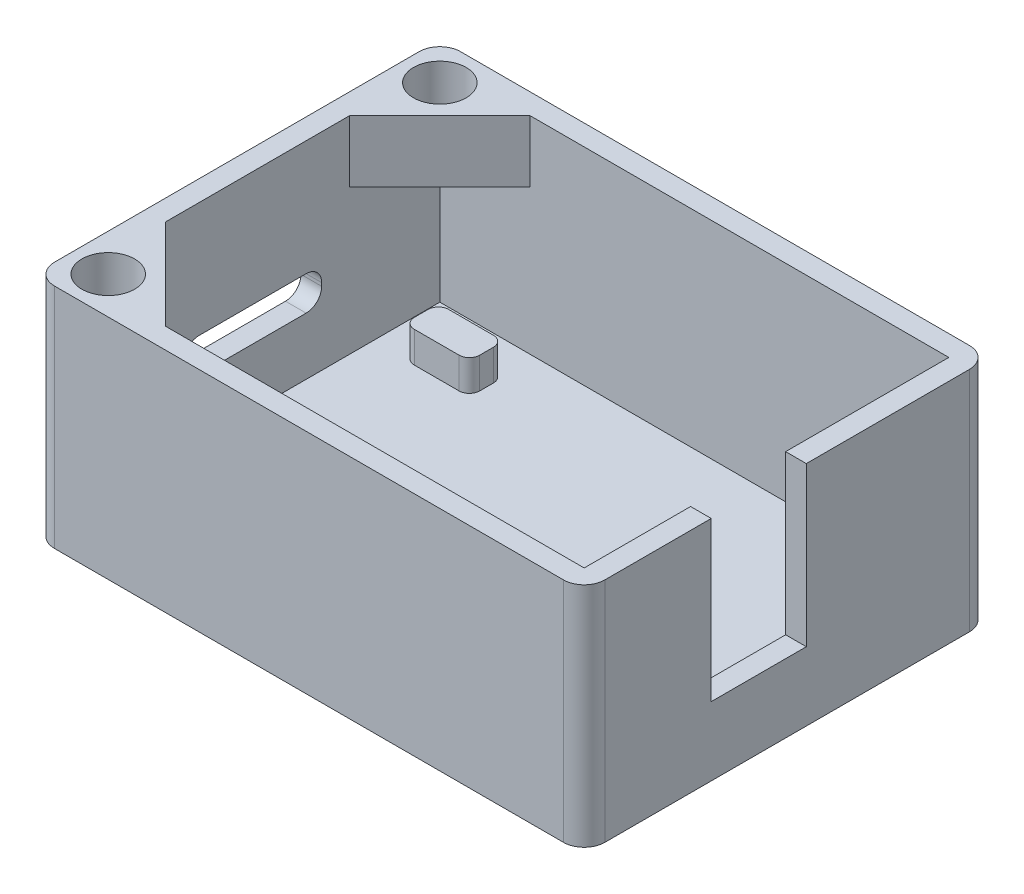
from build123d import *

# Parameters (mm, degrees)
SKETCH1_W           = 53.26
SKETCH1_H           = 39.29
BOSS_EXTRUDE1_DEPTH = 2
SKETCH2_W           = 53.26
SKETCH2_H           = 39.29
SKETCH2_W_2         = 49.26
SKETCH2_H_2         = 35.29
BOSS_EXTRUDE2_DEPTH = 20
SKETCH3_R           = 2
BOSS_EXTRUDE3_DEPTH = 3
SKETCH5_R           = 1.45
BOSS_EXTRUDE4_DEPTH = 1.6
CUT_EXTRUDE1_REACH  = 62.881
SKETCH6_W           = 9.2
SKETCH6_H           = 15.35
BOSS_EXTRUDE5_DEPTH = 6
SKETCH8_R           = 2.55
CUT_EXTRUDE2_DEPTH  = 4.2
CUT_EXTRUDE3_REACH  = 62.881
SKETCH9_W           = 13.35
SKETCH9_H           = 3.308526937
FILLET2_R           = 2
FILLET3_R           = 1.5
SKETCH10_W          = 1.076923076
SKETCH10_H          = 6.153846154
SKETCH10_W_2        = 1.076923077
SKETCH10_H_2        = 4.384615385
SKETCH10_W_3        = 2.076923077
SKETCH10_H_3        = 1
SKETCH10_H_4        = 4.384615384
CUT_EXTRUDE4_DEPTH  = 1


with BuildPart() as part:
    # Sketch1 → Boss-Extrude1 (new body)
    with BuildSketch(Plane(origin=(0, 0, 0), x_dir=(1, 0, 0), z_dir=(0, 1, 0))):
        Rectangle(SKETCH1_W, SKETCH1_H)
    extrude(amount=BOSS_EXTRUDE1_DEPTH)

    # Sketch2 → Boss-Extrude2 (add)
    with BuildSketch(Plane(origin=(0, 2, 0), x_dir=(1, 0, 0), z_dir=(0, 1, 0))):
        Rectangle(SKETCH2_W, SKETCH2_H)
        Rectangle(SKETCH2_W_2, SKETCH2_H_2, mode=Mode.SUBTRACT)
    extrude(amount=BOSS_EXTRUDE2_DEPTH)

    # Sketch3 → Boss-Extrude3 (add)
    with BuildSketch(Plane(origin=(0, 2, 0), x_dir=(1, 0, 0), z_dir=(0, 1, 0))):
        with Locations(Location((21.844, -14.732, 0), (0, 0, 270))):
            Circle(SKETCH3_R)
        with Locations(Location((-21.59, -14.732, 0), (0, 0, 270))):
            Circle(SKETCH3_R)
        with BuildLine():
            Line((-20.59, 14.465843174), (-16.261037059, 14.465843174))
            ThreePointArc((-16.261037059, 14.465843174), (-15.553930278, 14.172949955), (-15.261037059, 13.465843174))
            Line((-15.261037059, 13.465843174), (-15.261037059, 12.137442323))
            ThreePointArc((-15.261037059, 12.137442323), (-15.553930278, 11.430335542), (-16.261037059, 11.137442323))
            Line((-16.261037059, 11.137442323), (-20.59, 11.137442323))
            ThreePointArc((-20.59, 11.137442323), (-21.297106781, 11.430335542), (-21.59, 12.137442323))
            Line((-21.59, 12.137442323), (-21.59, 13.465843174))
            ThreePointArc((-21.59, 13.465843174), (-21.297106781, 14.172949955), (-20.59, 14.465843174))
        make_face()
        with BuildLine():
            Line((15.261037059, 13.465843174), (15.261037059, 12.137442323))
            ThreePointArc((15.261037059, 12.137442323), (15.553930278, 11.430335542), (16.261037059, 11.137442323))
            Line((16.261037059, 11.137442323), (20.59, 11.137442323))
            ThreePointArc((20.59, 11.137442323), (21.297106781, 11.430335542), (21.59, 12.137442323))
            Line((21.59, 12.137442323), (21.59, 13.465843174))
            ThreePointArc((21.59, 13.465843174), (21.297106781, 14.172949955), (20.59, 14.465843174))
            Line((20.59, 14.465843174), (16.261037059, 14.465843174))
            ThreePointArc((16.261037059, 14.465843174), (15.553930278, 14.172949955), (15.261037059, 13.465843174))
        make_face()
    extrude(amount=BOSS_EXTRUDE3_DEPTH)

    # Sketch5 → Boss-Extrude4 (add)
    with BuildSketch(Plane(origin=(0, 5, 0), x_dir=(1, 0, 0), z_dir=(0, 1, 0))):
        with Locations(Location((-21.59, -14.732, 0), (0, 0, 270))):
            Circle(SKETCH5_R)
        with Locations(Location((21.844, -14.732, 0), (0, 0, 270))):
            Circle(SKETCH5_R)
    extrude(amount=BOSS_EXTRUDE4_DEPTH)

    # Sketch6 → Cut-Extrude1 (cut, up to next)
    with BuildSketch(Plane(origin=(26.63, 0, 0), x_dir=(0, 0, -1), z_dir=(1, 0, 0)), mode=Mode.PRIVATE) as cut_extrude1_sk1:
        with Locations((-2.748, 14.325)):
            Rectangle(SKETCH6_W, SKETCH6_H)
    cut_extrude1_tool1 = extrude(cut_extrude1_sk1.sketch, amount=-CUT_EXTRUDE1_REACH, mode=Mode.PRIVATE) & part.part
    add(cut_extrude1_tool1.solids().sort_by_distance((26.63, 14.325, 2.748))[0], mode=Mode.SUBTRACT)

    # Sketch7 → Boss-Extrude5 (add)
    with BuildSketch(Plane(origin=(0, 22, 0), x_dir=(1, 0, 0), z_dir=(0, 1, 0))):
        Polygon((-26.63, 19.645), (-13.902077939, 19.645), (-26.63, 6.917077939), align=None)
        Polygon((-26.63, -19.645), (-13.902077939, -19.645), (-26.63, -6.917077939), align=None)
    extrude(amount=-BOSS_EXTRUDE5_DEPTH)

    # Sketch8 → Cut-Extrude2 (cut)
    with BuildSketch(Plane(origin=(0, 22, 0), x_dir=(1, 0, 0), z_dir=(0, 1, 0))):
        with Locations(Location((-23.03, 16.045, 0), (0, 0, 270))):
            Circle(SKETCH8_R)
        with Locations(Location((-23.03, -16.045, 0), (0, 0, 90))):
            Circle(SKETCH8_R)
    extrude(amount=-CUT_EXTRUDE2_DEPTH, mode=Mode.SUBTRACT)

    # Sketch9 → Cut-Extrude3 (cut, up to next)
    with BuildSketch(Plane.ZY.offset(26.63), mode=Mode.PRIVATE) as cut_extrude3_sk1:
        with Locations((0.468, 9.204263469)):
            Rectangle(SKETCH9_W, SKETCH9_H)
    cut_extrude3_tool1 = extrude(cut_extrude3_sk1.sketch, amount=-CUT_EXTRUDE3_REACH, mode=Mode.PRIVATE) & part.part
    add(cut_extrude3_tool1.solids().sort_by_distance((-26.63, 9.204263, 0.468))[0], mode=Mode.SUBTRACT)

    # Fillet2
    fillet2_edges = [part.edges().sort_by_distance(p)[0] for p in [
        (-26.63, 11, -19.645),
        (26.63, 11, -19.645),
        (26.63, 11, 19.645),
        (-26.63, 11, 19.645),
    ]]
    fillet(fillet2_edges, radius=FILLET2_R)

    # Fillet3
    fillet3_edges = [part.edges().sort_by_distance(p)[0] for p in [
        (-25.63, 7.55, -6.207),
        (-25.63, 10.858526937, 7.143),
        (-25.63, 7.55, 7.143),
        (-25.63, 10.858526937, -6.207),
    ]]
    fillet(fillet3_edges, radius=FILLET3_R)

    # Sketch10 → Cut-Extrude4 (cut)
    # profile 1 of 21: a face of its own
    with BuildSketch(Plane(origin=(0, 0, 0), x_dir=(-1, 0, 0), z_dir=(0, -1, 0))):
        with BuildLine():
            Line((-14.805590013, 7.334367776), (-15.595253474, 6.579560084))
            add(Edge.make_bspline(
                [(-15.595253474, 6.579560084), (-15.662239162, 6.648823398), (-15.793083197, 6.784116349), (-16.003922177, 6.963232293), (-16.223187039, 7.112501198), (-16.446612424, 7.238214519), (-16.678217106, 7.333325605), (-16.915323104, 7.402634656), (-17.15944441, 7.444889765), (-17.32465632, 7.449724497), (-17.407753474, 7.452156238)],
                knots=[0, 0, 0, 0, 1.115251505, 2.178435587, 3.19620269, 4.182487026, 5.141301733, 6.088180966, 7.038406374, 8, 8, 8, 8], degree=3))
            add(Edge.make_bspline(
                [(-17.407753474, 7.452156238), (-17.477149696, 7.450235078), (-17.614095493, 7.44644388), (-17.81516781, 7.418650663), (-18.007503873, 7.371387087), (-18.191762078, 7.306249125), (-18.367400239, 7.221964059), (-18.534786602, 7.118597123), (-18.693508483, 6.997081869), (-18.841469257, 6.858047021), (-18.976818574, 6.706141002), (-19.096408314, 6.544057642), (-19.196583904, 6.372168266), (-19.278796382, 6.192213641), (-19.342836723, 6.003360849), (-19.388569573, 5.805737034), (-19.415020232, 5.599106841), (-19.41896817, 5.458641175), (-19.420974628, 5.387252392)],
                knots=[0, 0, 0, 0, 1.035432265, 2.043311493, 3.022114605, 3.98653278, 4.95457646, 5.923598177, 6.917315552, 7.932509744, 8.948865224, 9.949768934, 10.933144597, 11.912367597, 12.897413939, 13.903909035, 14.934704909, 16, 16, 16, 16], degree=3))
            add(Edge.make_bspline(
                [(-19.420974628, 5.387252392), (-19.42039639, 5.337146749), (-19.41925667, 5.238387496), (-19.406780422, 5.092295153), (-19.386690721, 4.950551041), (-19.357615946, 4.813369867), (-19.321257654, 4.680632748), (-19.278601099, 4.551194566), (-19.225089078, 4.426843867), (-19.165689928, 4.306136398), (-19.0966094, 4.192365813), (-19.022127848, 4.083876118), (-18.941364765, 3.981199118), (-18.853797044, 3.884754562), (-18.758192278, 3.79604966), (-18.657021496, 3.712416951), (-18.548578089, 3.635950045), (-18.435114699, 3.56472992), (-18.315651147, 3.502860392), (-18.193428756, 3.446818553), (-18.066594388, 3.401304247), (-17.936692328, 3.364615564), (-17.804186799, 3.333417319), (-17.667781775, 3.314207601), (-17.528659717, 3.299660306), (-17.434636557, 3.298762095), (-17.387320782, 3.298310084)],
                knots=[0, 0, 0, 0, 1.103660481, 2.175337485, 3.227646561, 4.255952547, 5.262355991, 6.258840057, 7.255597736, 8.242457506, 9.22035537, 10.185017736, 11.140346927, 12.096287581, 13.051739095, 14.01125915, 14.986044842, 15.97314143, 16.960198552, 17.947847494, 18.933482797, 19.925264591, 20.920966487, 21.929612487, 22.958107872, 24, 24, 24, 24], degree=3))
            add(Edge.make_bspline(
                [(-17.387320782, 3.298310084), (-17.307065096, 3.300631504), (-17.149383542, 3.305192492), (-16.917963189, 3.340858767), (-16.697442648, 3.39952777), (-16.521247791, 3.468812455), (-16.383203775, 3.53723198), (-16.278112906, 3.600516672), (-16.169440757, 3.671307548), (-16.058992278, 3.752276333), (-15.945525145, 3.842451368), (-15.831042313, 3.943807655), (-15.712613002, 4.053007678), (-15.635031134, 4.130945879), (-15.595253474, 4.170906238)],
                knots=[0, 0, 0, 0, 1.404581149, 2.759636711, 4.088442092, 5.392261763, 6.066678138, 6.783632037, 7.538459478, 8.336747902, 9.180226004, 10.074962426, 11.012997595, 12, 12, 12, 12], degree=3))
            Line((-15.595253474, 4.170906238), (-14.829628474, 3.366819699))
            add(Edge.make_bspline(
                [(-14.829628474, 3.366819699), (-14.883447791, 3.314858839), (-14.988491587, 3.213442352), (-15.146947237, 3.069440403), (-15.305203465, 2.940038645), (-15.459437129, 2.820540359), (-15.612174738, 2.714426821), (-15.763400094, 2.621592055), (-15.91140126, 2.539688135), (-16.059251528, 2.47009633), (-16.207870899, 2.41100566), (-16.360782765, 2.360132472), (-16.518454595, 2.317095585), (-16.681849375, 2.282370469), (-16.849443058, 2.254525614), (-17.022804098, 2.235730498), (-17.200833301, 2.223095167), (-17.321593268, 2.221959777), (-17.38251309, 2.221387007)],
                knots=[0, 0, 0, 0, 1.244526981, 2.429050516, 3.560637417, 4.644440555, 5.67424972, 6.652764056, 7.595344123, 8.486817594, 9.369275933, 10.254498637, 11.166417451, 12.086725134, 13.032340136, 13.991389299, 14.986715468, 16, 16, 16, 16], degree=3))
            add(Edge.make_bspline(
                [(-17.38251309, 2.221387007), (-17.494415256, 2.224239617), (-17.713376692, 2.22982138), (-18.034258966, 2.27117847), (-18.339088513, 2.340512902), (-18.628606926, 2.438570912), (-18.902722144, 2.563835426), (-19.161364042, 2.717403837), (-19.404115745, 2.898868139), (-19.629016298, 3.106101395), (-19.832449551, 3.334973128), (-20.012260989, 3.580718581), (-20.161001016, 3.844545502), (-20.284503066, 4.122556326), (-20.381080045, 4.416019723), (-20.449053866, 4.725253131), (-20.490972825, 5.049957966), (-20.495558818, 5.271738854), (-20.497897705, 5.384848546)],
                knots=[0, 0, 0, 0, 1.078019885, 2.10938526, 3.111377082, 4.085535484, 5.04941344, 6.010039228, 6.978205633, 7.964457913, 8.951525778, 9.924444315, 10.892603023, 11.863865945, 12.85144698, 13.863884204, 14.910567087, 16, 16, 16, 16], degree=3))
            add(Edge.make_bspline(
                [(-20.497897705, 5.384848546), (-20.496909405, 5.458617721), (-20.494950836, 5.604810198), (-20.474366091, 5.82016356), (-20.445669761, 6.030094567), (-20.400145643, 6.23242344), (-20.345270808, 6.429875922), (-20.277026741, 6.620305934), (-20.195522438, 6.804260792), (-20.103384973, 6.982048448), (-19.999150781, 7.152504201), (-19.882709746, 7.314163568), (-19.757059513, 7.46827453), (-19.619180914, 7.612792519), (-19.471077503, 7.74898643), (-19.312080613, 7.876118204), (-19.143146528, 7.996011052), (-18.963818008, 8.105573229), (-18.777578929, 8.204678042), (-18.586778253, 8.29209272), (-18.391884758, 8.365151261), (-18.19372247, 8.425750625), (-17.991454156, 8.470983766), (-17.786523556, 8.505223794), (-17.577186957, 8.524364188), (-17.436635566, 8.527497593), (-17.365686166, 8.529079315)],
                knots=[0, 0, 0, 0, 1.071919942, 2.124283339, 3.142214191, 4.149696895, 5.136002878, 6.119640489, 7.086990633, 8.058538607, 9.028339693, 9.988281803, 10.952401235, 11.916291999, 12.888973767, 13.874849856, 14.873389453, 15.898127285, 16.927174885, 17.938320013, 18.946391617, 19.950418109, 20.947802303, 21.956882652, 22.968648068, 24, 24, 24, 24], degree=3))
            add(Edge.make_bspline(
                [(-17.365686166, 8.529079315), (-17.305159054, 8.528172633), (-17.184734143, 8.526368695), (-17.005401242, 8.511330911), (-16.827502561, 8.487714224), (-16.651675033, 8.452081672), (-16.476660959, 8.409781331), (-16.304760221, 8.354394868), (-16.13326099, 8.292656218), (-15.964852979, 8.218860268), (-15.799301113, 8.138305323), (-15.640483707, 8.046912813), (-15.48573423, 7.950306929), (-15.338481839, 7.842770114), (-15.195968178, 7.728202927), (-15.058938464, 7.606070849), (-14.928595214, 7.474337578), (-14.846799027, 7.381260245), (-14.805590013, 7.334367776)],
                knots=[0, 0, 0, 0, 0.996412454, 1.982464992, 2.961075852, 3.949442424, 4.934965278, 5.923860011, 6.921385422, 7.934793307, 8.949617135, 9.951082467, 10.950285876, 11.951772932, 12.951063433, 13.960125323, 14.972308753, 16, 16, 16, 16], degree=3))
        make_face()
    # profile 2 of 21: a face of its own
    with BuildSketch(Plane(origin=(0, 0, 0), x_dir=(-1, 0, 0), z_dir=(0, -1, 0))):
        with Locations((-13.420974628, 5.452156238)):
            Rectangle(SKETCH10_W, SKETCH10_H)
    # profile 3 of 21: a face of its own
    with BuildSketch(Plane(origin=(0, 0, 0), x_dir=(-1, 0, 0), z_dir=(0, -1, 0))):
        with BuildLine():
            add(Edge.make_bspline(
                [(-9.793570782, 6.836771623), (-9.742655938, 6.835865558), (-9.641821476, 6.83407114), (-9.491641142, 6.819134247), (-9.344086306, 6.794764089), (-9.198308843, 6.76320899), (-9.055662433, 6.718995575), (-8.915398913, 6.665968422), (-8.776264149, 6.605087048), (-8.641711438, 6.532616918), (-8.510768736, 6.454016453), (-8.386627263, 6.36731369), (-8.270317926, 6.273189652), (-8.159681629, 6.173826677), (-8.059874201, 6.064898826), (-7.964517414, 5.951654699), (-7.87876316, 5.830037155), (-7.799367075, 5.703009731), (-7.728681311, 5.571307004), (-7.667303725, 5.435845143), (-7.614033751, 5.298497004), (-7.572324428, 5.157589595), (-7.537792954, 5.014980965), (-7.516001139, 4.868923553), (-7.50050867, 4.720917735), (-7.498771473, 4.621268038), (-7.497897705, 4.571146623)],
                knots=[0, 0, 0, 0, 1.022364134, 2.024744242, 3.027414945, 4.024939316, 5.017584196, 6.023349371, 7.035562955, 8.064994934, 9.090267829, 10.101425541, 11.102933353, 12.093946398, 13.084502048, 14.067315274, 15.065326281, 16.070028806, 17.074376865, 18.064572984, 19.055292013, 20.030201733, 21.013838017, 21.999348303, 22.993720005, 24, 24, 24, 24], degree=3))
            add(Edge.make_bspline(
                [(-7.497897705, 4.571146623), (-7.498819823, 4.520633633), (-7.500653202, 4.420202359), (-7.515440641, 4.270804363), (-7.539904079, 4.124060111), (-7.571580289, 3.979105107), (-7.615628244, 3.837794189), (-7.667093578, 3.698044378), (-7.7302693, 3.561760516), (-7.800114716, 3.427455875), (-7.880021285, 3.299082631), (-7.965701308, 3.176246773), (-8.060658695, 3.062170862), (-8.159667136, 2.953317087), (-8.267422826, 2.853366395), (-8.382205784, 2.760695855), (-8.503022306, 2.674172526), (-8.630741192, 2.59582641), (-8.763726577, 2.526986472), (-8.899735685, 2.46492165), (-9.039563824, 2.413248254), (-9.18292161, 2.371110022), (-9.329895987, 2.338483444), (-9.480162471, 2.316319822), (-9.633397446, 2.300905278), (-9.736641139, 2.299180718), (-9.78876309, 2.298310084)],
                knots=[0, 0, 0, 0, 1.012026251, 2.012137606, 3.004615893, 3.992048833, 4.982446996, 5.968083444, 6.973977695, 7.990229942, 8.999482246, 10.001782172, 10.988562221, 11.971415814, 12.948383116, 13.930088534, 14.925840678, 15.924049238, 16.929462851, 17.924729459, 18.917889337, 19.913673841, 20.916777188, 21.931792057, 22.95587778, 24, 24, 24, 24], degree=3))
            add(Edge.make_bspline(
                [(-9.78876309, 2.298310084), (-9.86497601, 2.300547084), (-10.015192837, 2.304956244), (-10.236426709, 2.335157837), (-10.448959429, 2.387142697), (-10.653137316, 2.459608445), (-10.849225604, 2.552470602), (-11.03551299, 2.667401622), (-11.213852526, 2.802138844), (-11.381155237, 2.955543456), (-11.534427185, 3.123842207), (-11.668328672, 3.303500099), (-11.78202187, 3.49182436), (-11.875404491, 3.689029745), (-11.947476831, 3.895386676), (-11.999525358, 4.110278217), (-12.029763876, 4.334308397), (-12.034135745, 4.486520964), (-12.036359243, 4.563935084)],
                knots=[0, 0, 0, 0, 1.029999031, 2.030143771, 3.011211297, 3.982305373, 4.953580601, 5.938004764, 6.935448627, 7.970290061, 9.001484052, 10.007591832, 10.993831261, 11.969999897, 12.951306496, 13.942897864, 14.953773953, 16, 16, 16, 16], degree=3))
            add(Edge.make_bspline(
                [(-12.036359243, 4.563935084), (-12.034058205, 4.646596394), (-12.02953556, 4.809065545), (-11.993623769, 5.047086552), (-11.936276512, 5.274980387), (-11.853958138, 5.492109557), (-11.748803654, 5.698874528), (-11.620433862, 5.894839211), (-11.468214348, 6.080047992), (-11.351644681, 6.192068612), (-11.292368859, 6.249031238)],
                knots=[0, 0, 0, 0, 1.043912699, 2.05178951, 3.033892, 4.007821512, 4.978932272, 5.95884105, 6.962068106, 8, 8, 8, 8], degree=3))
            add(Edge.make_bspline(
                [(-11.292368859, 6.249031238), (-11.237977367, 6.296246848), (-11.130674213, 6.389393472), (-10.956341904, 6.507534694), (-10.777845291, 6.609572667), (-10.593045016, 6.693466859), (-10.401425903, 6.756721726), (-10.203969892, 6.80276561), (-10.00071804, 6.831047113), (-9.862970767, 6.834853756), (-9.793570782, 6.836771623)],
                knots=[0, 0, 0, 0, 1.048115528, 2.067714963, 3.060638214, 4.039924844, 5.017819947, 5.994373833, 6.98952318, 8, 8, 8, 8], degree=3))
        make_face()
        with BuildLine():
            add(Edge.make_bspline(
                [(-9.76953232, 5.836771623), (-9.811227827, 5.835385802), (-9.893305879, 5.832657799), (-10.01412693, 5.818017338), (-10.128400751, 5.788010455), (-10.238397035, 5.749849912), (-10.342169937, 5.698815563), (-10.442561426, 5.639093613), (-10.534351367, 5.564358942), (-10.621981767, 5.482380476), (-10.701530637, 5.391345588), (-10.769313828, 5.292163147), (-10.829879611, 5.188627664), (-10.875803573, 5.076948576), (-10.913810042, 4.960178396), (-10.939532364, 4.836430474), (-10.957433304, 4.707087141), (-10.958762196, 4.618486072), (-10.959436166, 4.573550469)],
                knots=[0, 0, 0, 0, 1.030650113, 2.02884584, 2.99876339, 3.944280128, 4.900564847, 5.851248946, 6.823638398, 7.81794922, 8.81432732, 9.802856497, 10.78262424, 11.771747962, 12.779760563, 13.812642396, 14.89064281, 16, 16, 16, 16], degree=3))
            add(Edge.make_bspline(
                [(-10.959436166, 4.573550469), (-10.958647529, 4.52703021), (-10.957106289, 4.436115298), (-10.941146422, 4.303367301), (-10.914828077, 4.177390331), (-10.877437956, 4.058378996), (-10.830413565, 3.945479048), (-10.772720091, 3.839323931), (-10.703748644, 3.740551915), (-10.625551762, 3.64928463), (-10.539929517, 3.566440306), (-10.446111355, 3.495346406), (-10.348026026, 3.433575244), (-10.243413114, 3.383963466), (-10.13375842, 3.345659148), (-10.018736426, 3.317456968), (-9.897742691, 3.302263), (-9.815244085, 3.299645841), (-9.77313809, 3.298310084)],
                knots=[0, 0, 0, 0, 1.141730614, 2.231293227, 3.276944405, 4.297399982, 5.28939179, 6.275415646, 7.257752684, 8.24146775, 9.222424823, 10.176631434, 11.126518621, 12.063689483, 13.012557477, 13.974037417, 14.965980454, 16, 16, 16, 16], degree=3))
            add(Edge.make_bspline(
                [(-9.77313809, 3.298310084), (-9.731011035, 3.29949484), (-9.648417552, 3.30181765), (-9.527281733, 3.319211826), (-9.411672352, 3.346586831), (-9.301081121, 3.385220821), (-9.196402181, 3.435894512), (-9.097234813, 3.497961196), (-9.002706626, 3.570043948), (-8.915935322, 3.654451387), (-8.835612786, 3.746003301), (-8.765174725, 3.845296728), (-8.706314026, 3.951451872), (-8.658037712, 4.063800805), (-8.620574294, 4.182189103), (-8.594691653, 4.307056802), (-8.576781142, 4.438016926), (-8.575482306, 4.527814674), (-8.574820782, 4.573550469)],
                knots=[0, 0, 0, 0, 1.031504075, 2.022346795, 2.991027682, 3.937587355, 4.885570121, 5.833146507, 6.798790848, 7.791235734, 8.792807298, 9.778388351, 10.766749885, 11.760164525, 12.768777521, 13.802286646, 14.880660483, 16, 16, 16, 16], degree=3))
            add(Edge.make_bspline(
                [(-8.574820782, 4.573550469), (-8.575619452, 4.619270279), (-8.577186701, 4.708987378), (-8.593147705, 4.840124624), (-8.619207769, 4.964588715), (-8.657080141, 5.0818482), (-8.703825025, 5.193240823), (-8.761558376, 5.298196409), (-8.830869969, 5.396198022), (-8.909446987, 5.486759718), (-8.996352763, 5.568441548), (-9.088542016, 5.641281912), (-9.188122831, 5.701526489), (-9.293227011, 5.751189526), (-9.404134189, 5.789398143), (-9.520719853, 5.817760153), (-9.643341302, 5.832737917), (-9.727029031, 5.835413002), (-9.76953232, 5.836771623)],
                knots=[0, 0, 0, 0, 1.123894411, 2.205445421, 3.243160173, 4.246488011, 5.231014757, 6.210004299, 7.185865357, 8.177612767, 9.153374344, 10.115157457, 11.061423229, 12.009021698, 12.96873347, 13.94135618, 14.954456845, 16, 16, 16, 16], degree=3))
        make_face(mode=Mode.SUBTRACT)
    # profile 4 of 21: a face of its own
    with BuildSketch(Plane(origin=(0, 0, 0), x_dir=(-1, 0, 0), z_dir=(0, -1, 0))):
        with BuildLine():
            Line((-6.574820782, 6.759848546), (-5.497897705, 6.759848546))
            Line((-5.497897705, 6.759848546), (-5.497897705, 4.655281238))
            add(Edge.make_bspline(
                [(-5.497897705, 4.655281238), (-5.497802074, 4.605997352), (-5.497618534, 4.511409538), (-5.492511218, 4.37556292), (-5.485344644, 4.251337409), (-5.476401245, 4.138586519), (-5.463052649, 4.037581454), (-5.447642258, 3.948515036), (-5.430171845, 3.870745531), (-5.401762749, 3.784061049), (-5.357316203, 3.689201555), (-5.290194053, 3.588497062), (-5.208889551, 3.501417122), (-5.114501176, 3.427188944), (-5.006064991, 3.36869551), (-4.885074963, 3.329055403), (-4.753053393, 3.302413129), (-4.661100566, 3.299713811), (-4.61328232, 3.298310084)],
                knots=[0, 0, 0, 0, 1.267339619, 2.432334223, 3.495366327, 4.467371443, 5.340232306, 6.114347373, 6.791623365, 7.387877112, 8.457231658, 9.474542289, 10.487879852, 11.508108106, 12.54995813, 13.638205937, 14.771795776, 16, 16, 16, 16], degree=3))
            add(Edge.make_bspline(
                [(-4.61328232, 3.298310084), (-4.565506508, 3.29991224), (-4.473315877, 3.303003841), (-4.340415916, 3.327112966), (-4.219140909, 3.368424757), (-4.108245284, 3.424459324), (-4.010999361, 3.499452049), (-3.926331312, 3.588811201), (-3.855042802, 3.693978252), (-3.820785385, 3.77242986), (-3.803186166, 3.812733161)],
                knots=[0, 0, 0, 0, 1.116871431, 2.155171802, 3.144773418, 4.104381479, 5.046960687, 6.001340237, 6.973219418, 8, 8, 8, 8], degree=3))
            add(Edge.make_bspline(
                [(-3.803186166, 3.812733161), (-3.796727844, 3.830636249), (-3.782471844, 3.870155251), (-3.769783721, 3.938330967), (-3.756127522, 4.018733186), (-3.745324984, 4.113000437), (-3.739212527, 4.220548914), (-3.732663655, 4.341514166), (-3.729326232, 4.475775717), (-3.728893431, 4.569943418), (-3.728666936, 4.619223546)],
                knots=[0, 0, 0, 0, 0.56094539, 1.238222264, 2.041156151, 2.969685991, 4.036367568, 5.220421584, 6.545382566, 8, 8, 8, 8], degree=3))
            Line((-3.728666936, 4.619223546), (-3.728666936, 6.759848546))
            Line((-3.728666936, 6.759848546), (-2.651743859, 6.759848546))
            Line((-2.651743859, 6.759848546), (-2.651743859, 4.917300469))
            add(Edge.make_bspline(
                [(-2.651743859, 4.917300469), (-2.651930327, 4.825943028), (-2.652287843, 4.650783162), (-2.66253403, 4.399522027), (-2.67667493, 4.171075506), (-2.694885688, 3.964814612), (-2.721125141, 3.780653746), (-2.753335467, 3.61902477), (-2.788970372, 3.478859619), (-2.821648908, 3.395810798), (-2.836840013, 3.357204315)],
                knots=[0, 0, 0, 0, 1.388070971, 2.661352173, 3.82033814, 4.865898334, 5.806910977, 6.645039373, 7.370126333, 8, 8, 8, 8], degree=3))
            add(Edge.make_bspline(
                [(-2.836840013, 3.357204315), (-2.856311097, 3.315651811), (-2.894745343, 3.233630737), (-2.961435906, 3.117014936), (-3.033332069, 3.006530702), (-3.113854678, 2.904778728), (-3.201360017, 2.810724867), (-3.293374585, 2.722231046), (-3.394042241, 2.642900868), (-3.5007523, 2.570692943), (-3.614993753, 2.506594577), (-3.73598413, 2.449792568), (-3.865030923, 2.403565472), (-4.001015145, 2.364381488), (-4.144563593, 2.335159976), (-4.295387106, 2.31302691), (-4.453651101, 2.301588457), (-4.561584215, 2.299420781), (-4.61688809, 2.298310084)],
                knots=[0, 0, 0, 0, 0.997311338, 1.968606903, 2.91805772, 3.860812155, 4.785445165, 5.709667791, 6.633356648, 7.568312411, 8.508286151, 9.478643871, 10.470653671, 11.485274776, 12.552984541, 13.653035246, 14.797438149, 16, 16, 16, 16], degree=3))
            add(Edge.make_bspline(
                [(-4.61688809, 2.298310084), (-4.676631815, 2.299022072), (-4.793530026, 2.30041519), (-4.964316679, 2.317475429), (-5.127078656, 2.33954916), (-5.279998729, 2.377078548), (-5.425212498, 2.420558222), (-5.561052827, 2.476049851), (-5.688074793, 2.541292284), (-5.806528329, 2.615898728), (-5.915494754, 2.700552871), (-6.017397056, 2.791595455), (-6.108945393, 2.892648775), (-6.193128443, 3.000592265), (-6.269006679, 3.116419382), (-6.33661776, 3.23971828), (-6.396018956, 3.371049785), (-6.427712441, 3.463094417), (-6.443811166, 3.509848546)],
                knots=[0, 0, 0, 0, 1.211240017, 2.369985978, 3.478996442, 4.539426614, 5.559871561, 6.551301256, 7.510778031, 8.453136967, 9.386094087, 10.30661716, 11.221130616, 12.147659962, 13.080758632, 14.026335491, 14.997475882, 16, 16, 16, 16], degree=3))
            add(Edge.make_bspline(
                [(-6.443811166, 3.509848546), (-6.454794242, 3.546159591), (-6.478454347, 3.624382049), (-6.50400001, 3.754378643), (-6.524432362, 3.904206996), (-6.544308307, 4.074014486), (-6.558174129, 4.264085795), (-6.567236995, 4.474119064), (-6.573360494, 4.704525014), (-6.574319679, 4.864812253), (-6.574820782, 4.948550469)],
                knots=[0, 0, 0, 0, 0.627914866, 1.352675004, 2.190563461, 3.132055958, 4.183353232, 5.345633452, 6.613289997, 8, 8, 8, 8], degree=3))
            Line((-6.574820782, 4.948550469), (-6.574820782, 6.759848546))
        make_face()
    # profile 5 of 21: a face of its own
    with BuildSketch(Plane(origin=(0, 0, 0), x_dir=(-1, 0, 0), z_dir=(0, -1, 0))):
        with BuildLine():
            Line((1.732871526, 8.529079315), (2.809794603, 8.529079315))
            Line((2.809794603, 8.529079315), (2.809794603, 2.375233161))
            Line((2.809794603, 2.375233161), (1.732871526, 2.375233161))
            Line((1.732871526, 2.375233161), (1.732871526, 2.853598546))
            add(Edge.make_bspline(
                [(1.732871526, 2.853598546), (1.679510384, 2.80703497), (1.575946946, 2.716664265), (1.412764478, 2.599405977), (1.249105173, 2.502683044), (1.084182642, 2.425648503), (0.915462096, 2.368766423), (0.741728813, 2.327582469), (0.56048085, 2.303295283), (0.437270983, 2.299989127), (0.374698449, 2.298310084)],
                knots=[0, 0, 0, 0, 1.129196829, 2.191548051, 3.199897424, 4.157751732, 5.089409408, 6.034969131, 7.002052659, 8, 8, 8, 8], degree=3))
            add(Edge.make_bspline(
                [(0.374698449, 2.298310084), (0.304457998, 2.299890275), (0.165658887, 2.30301282), (-0.038013399, 2.335882654), (-0.23467924, 2.38619726), (-0.424178997, 2.457398717), (-0.606167894, 2.549661846), (-0.782038696, 2.660579374), (-0.948776443, 2.794045169), (-1.10776917, 2.944284507), (-1.253341956, 3.109548847), (-1.38060306, 3.287544344), (-1.487874713, 3.475746524), (-1.575756638, 3.67353141), (-1.644887121, 3.88075384), (-1.694167263, 4.098071059), (-1.723242604, 4.325560683), (-1.726841311, 4.480517706), (-1.728666936, 4.559127392)],
                knots=[0, 0, 0, 0, 0.980476535, 1.937477201, 2.874147792, 3.812856188, 4.758993464, 5.720109578, 6.712210464, 7.737600662, 8.772720504, 9.783789959, 10.789002326, 11.793715968, 12.802552247, 13.835794126, 14.902098527, 16, 16, 16, 16], degree=3))
            add(Edge.make_bspline(
                [(-1.728666936, 4.559127392), (-1.726750936, 4.640527825), (-1.72299249, 4.800203844), (-1.695499679, 5.03452081), (-1.64712894, 5.257226392), (-1.581171962, 5.468629069), (-1.496329762, 5.668765365), (-1.392997632, 5.857963165), (-1.269769834, 6.035727937), (-1.127771641, 6.199034001), (-0.97444847, 6.348711896), (-0.810419783, 6.479018374), (-0.638250628, 6.589719789), (-0.457758046, 6.680095104), (-0.268967813, 6.749932574), (-0.07262527, 6.800989467), (0.132141207, 6.831625396), (0.27162979, 6.835041968), (0.342246526, 6.836771623)],
                knots=[0, 0, 0, 0, 1.136281865, 2.228943489, 3.287578264, 4.313574083, 5.316051562, 6.317280042, 7.318008486, 8.329309503, 9.333984563, 10.305318864, 11.248632312, 12.186624717, 13.117503092, 14.05354244, 15.014596925, 16, 16, 16, 16], degree=3))
            add(Edge.make_bspline(
                [(0.342246526, 6.836771623), (0.407618333, 6.834697582), (0.536891084, 6.830596168), (0.727849205, 6.804778786), (0.911587184, 6.756166908), (1.090336512, 6.693534076), (1.261775788, 6.609251648), (1.426826076, 6.508008276), (1.585922258, 6.388518194), (1.68326919, 6.29611469), (1.732871526, 6.249031238)],
                knots=[0, 0, 0, 0, 1.011899165, 2.001030639, 2.974036179, 3.948778736, 4.92769327, 5.924124564, 6.942254589, 8, 8, 8, 8], degree=3))
            Line((1.732871526, 6.249031238), (1.732871526, 8.529079315))
        make_face()
        with BuildLine():
            add(Edge.make_bspline(
                [(0.568208064, 5.836771623), (0.525295854, 5.835454928), (0.441190724, 5.832874292), (0.317502621, 5.817351588), (0.1992939, 5.789999893), (0.087407614, 5.749593636), (-0.01982375, 5.700372928), (-0.120771871, 5.638724801), (-0.216269901, 5.565858025), (-0.305756207, 5.483536704), (-0.387336161, 5.393050521), (-0.457662842, 5.29431049), (-0.517429159, 5.189977094), (-0.56797593, 5.079736639), (-0.60415595, 4.962284638), (-0.632810512, 4.839150109), (-0.647680374, 4.709327105), (-0.650375811, 4.620856745), (-0.651743859, 4.575954315)],
                knots=[0, 0, 0, 0, 1.04836806, 2.054732945, 3.03993516, 4.00574415, 4.955904794, 5.917688631, 6.888591924, 7.88601754, 8.884115178, 9.859153345, 10.841239365, 11.818093293, 12.814750328, 13.83810466, 14.90274714, 16, 16, 16, 16], degree=3))
            add(Edge.make_bspline(
                [(-0.651743859, 4.575954315), (-0.650396708, 4.530644594), (-0.647742164, 4.441362313), (-0.63257008, 4.310444205), (-0.604946629, 4.18551097), (-0.564645054, 4.067572607), (-0.515427484, 3.955037737), (-0.455518632, 3.848425721), (-0.381931101, 3.749621591), (-0.300279634, 3.656287311), (-0.20895753, 3.57294342), (-0.112919133, 3.498941698), (-0.010852635, 3.437024504), (0.096134615, 3.386982636), (0.207682492, 3.34620272), (0.32518947, 3.319194779), (0.447504419, 3.301929114), (0.530889749, 3.299524757), (0.573015757, 3.298310084)],
                knots=[0, 0, 0, 0, 1.099136573, 2.165835871, 3.191374663, 4.196217796, 5.183857741, 6.167377911, 7.154730987, 8.166690795, 9.170734848, 10.148332609, 11.103258353, 12.059567475, 13.009337315, 13.978056681, 14.978520572, 16, 16, 16, 16], degree=3))
            add(Edge.make_bspline(
                [(0.573015757, 3.298310084), (0.616727257, 3.299634161), (0.702425559, 3.30223007), (0.828131571, 3.317611112), (0.94792826, 3.345063096), (1.061317208, 3.385700687), (1.170030321, 3.434568088), (1.273086564, 3.495011563), (1.369367619, 3.56771113), (1.459361106, 3.650776638), (1.541822789, 3.742001695), (1.613122032, 3.842036545), (1.675226282, 3.947681798), (1.724068417, 4.061435293), (1.762855922, 4.181306875), (1.790685061, 4.308040493), (1.8058225, 4.44177278), (1.808453828, 4.533050278), (1.809794603, 4.579560084)],
                knots=[0, 0, 0, 0, 1.050008698, 2.058587853, 3.036635738, 3.995319155, 4.947022481, 5.895997462, 6.858296291, 7.838991643, 8.833936038, 9.806048392, 10.784806122, 11.771666913, 12.772873988, 13.80724452, 14.882696879, 16, 16, 16, 16], degree=3))
            add(Edge.make_bspline(
                [(1.809794603, 4.579560084), (1.808470489, 4.625269944), (1.805884109, 4.714554578), (1.790619778, 4.845494598), (1.762593067, 4.969739747), (1.724603873, 5.087518401), (1.674892822, 5.198561263), (1.612741582, 5.301637131), (1.54222445, 5.400317198), (1.458849797, 5.489077762), (1.369343825, 5.571541812), (1.271646801, 5.64204289), (1.168836712, 5.702802676), (1.06028189, 5.752688804), (0.944977167, 5.789257226), (0.824975754, 5.817570818), (0.698405379, 5.832864976), (0.612315393, 5.835448156), (0.568208064, 5.836771623)],
                knots=[0, 0, 0, 0, 1.106611376, 2.161533483, 3.185006901, 4.184773755, 5.152708835, 6.122342771, 7.094156588, 8.082475533, 9.064254463, 10.03606828, 10.992420271, 11.951521816, 12.920622147, 13.915721683, 14.932141191, 16, 16, 16, 16], degree=3))
        make_face(mode=Mode.SUBTRACT)
    # profile 6 of 21: a face of its own
    with BuildSketch(Plane(origin=(0, 0, 0), x_dir=(-1, 0, 0), z_dir=(0, -1, 0))):
        with Locations((4.348256142, 5.452156238)):
            Rectangle(SKETCH10_W_2, SKETCH10_H)
    # profile 7 of 21: a face of its own
    with BuildSketch(Plane(origin=(0, 0, 0), x_dir=(-1, 0, 0), z_dir=(0, -1, 0))):
        with BuildLine():
            add(Edge.make_bspline(
                [(6.345852295, 8.606002392), (6.392267672, 8.603725078), (6.483408737, 8.599253352), (6.613980715, 8.555663975), (6.733819328, 8.48725175), (6.839759985, 8.393388547), (6.927871518, 8.281298714), (6.995192001, 8.155806694), (7.032693438, 8.016765578), (7.037901832, 7.920717429), (7.040563834, 7.871627392)],
                knots=[0, 0, 0, 0, 0.989868614, 1.943702388, 2.910836514, 3.924849579, 4.949916355, 5.946401046, 6.950409252, 8, 8, 8, 8], degree=3))
            add(Edge.make_bspline(
                [(7.040563834, 7.871627392), (7.037997074, 7.822899121), (7.032995621, 7.727949766), (6.994328882, 7.590796197), (6.929710409, 7.465365129), (6.840885228, 7.354940039), (6.736093106, 7.262588558), (6.618873059, 7.19293435), (6.489552339, 7.15176984), (6.399825508, 7.146924303), (6.354265757, 7.14446393)],
                knots=[0, 0, 0, 0, 1.05296456, 2.051751585, 3.055639087, 4.085634717, 5.099016424, 6.062201612, 7.016062274, 8, 8, 8, 8], degree=3))
            add(Edge.make_bspline(
                [(6.354265757, 7.14446393), (6.307445212, 7.146733103), (6.215511224, 7.151188714), (6.083868287, 7.194880081), (5.962431333, 7.262753515), (5.856950245, 7.358534489), (5.767829639, 7.471420805), (5.703449741, 7.599834387), (5.663178522, 7.739826264), (5.658398364, 7.837296951), (5.655948449, 7.887252392)],
                knots=[0, 0, 0, 0, 0.989065327, 1.942068821, 2.907541208, 3.917690034, 4.939857478, 5.938239964, 6.943311734, 8, 8, 8, 8], degree=3))
            add(Edge.make_bspline(
                [(5.655948449, 7.887252392), (5.658614626, 7.935153227), (5.663851947, 8.029247503), (5.701578022, 8.165197328), (5.767354848, 8.288579631), (5.854831705, 8.398617554), (5.959841847, 8.490729855), (6.079608519, 8.557064356), (6.209301743, 8.598853368), (6.299865461, 8.603594778), (6.345852295, 8.606002392)],
                knots=[0, 0, 0, 0, 1.038616768, 2.040212704, 3.031499824, 4.052181184, 5.074969369, 6.039807101, 7.004644834, 8, 8, 8, 8], degree=3))
        make_face()
    # profile 8 of 21: a face of its own
    with BuildSketch(Plane(origin=(0, 0, 0), x_dir=(-1, 0, 0), z_dir=(0, -1, 0))):
        with Locations((6.348256142, 4.567540854)):
            Rectangle(SKETCH10_W_2, SKETCH10_H_2)
    # profile 9 of 21: a face of its own
    with BuildSketch(Plane(origin=(0, 0, 0), x_dir=(-1, 0, 0), z_dir=(0, -1, 0))):
        with BuildLine():
            Line((11.11748691, 6.759848546), (12.271333064, 6.759848546))
            Line((12.271333064, 6.759848546), (12.271333064, 3.01946393))
            add(Edge.make_bspline(
                [(12.271333064, 3.01946393), (12.269946442, 2.93008065), (12.267268819, 2.757478027), (12.24684315, 2.507332243), (12.212780715, 2.275433342), (12.163766073, 2.061452901), (12.100461305, 1.8661774), (12.023037173, 1.688957645), (11.93306787, 1.528843253), (11.859093076, 1.435284571), (11.823015757, 1.389656238)],
                knots=[0, 0, 0, 0, 1.243822755, 2.401870584, 3.490053692, 4.503076575, 5.453444971, 6.342269266, 7.191528908, 8, 8, 8, 8], degree=3))
            add(Edge.make_bspline(
                [(11.823015757, 1.389656238), (11.771208227, 1.332829286), (11.667855458, 1.219463084), (11.485638733, 1.076398949), (11.286013598, 0.954124602), (11.066942845, 0.853914914), (10.828687411, 0.777587101), (10.571859351, 0.722617472), (10.296295845, 0.688379798), (10.105971504, 0.684777614), (10.00811191, 0.682925469)],
                knots=[0, 0, 0, 0, 0.916003385, 1.827369254, 2.751972866, 3.703651841, 4.69362366, 5.730423306, 6.83304546, 8, 8, 8, 8], degree=3))
            add(Edge.make_bspline(
                [(10.00811191, 0.682925469), (9.904668658, 0.684526895), (9.705720647, 0.68760685), (9.419836458, 0.717735871), (9.159423509, 0.767311095), (8.923258905, 0.837105986), (8.709142425, 0.92716158), (8.513036373, 1.035143433), (8.335317365, 1.164244626), (8.173299095, 1.309375529), (8.030739072, 1.473723292), (7.909006799, 1.655783196), (7.805297231, 1.853880656), (7.754089453, 1.995542999), (7.728063834, 2.067540853)],
                knots=[0, 0, 0, 0, 1.29412125, 2.488928388, 3.592140377, 4.607309753, 5.564519828, 6.493640275, 7.402258018, 8.307438948, 9.210158992, 10.116782752, 11.042881838, 12, 12, 12, 12], degree=3))
            Line((7.728063834, 2.067540853), (8.925179218, 2.067540853))
            add(Edge.make_bspline(
                [(8.925179218, 2.067540853), (8.952843275, 2.037085364), (9.008522945, 1.975787354), (9.107005108, 1.898004332), (9.215948702, 1.831425858), (9.33623268, 1.776908817), (9.468358572, 1.735453496), (9.611426977, 1.703958584), (9.766078729, 1.686209553), (9.872651003, 1.684042476), (9.927583064, 1.682925469)],
                knots=[0, 0, 0, 0, 0.888971165, 1.789239437, 2.70354581, 3.646217955, 4.638595249, 5.694475788, 6.811630907, 8, 8, 8, 8], degree=3))
            add(Edge.make_bspline(
                [(9.927583064, 1.682925469), (9.997002745, 1.684222536), (10.129588251, 1.686699821), (10.317167495, 1.713786236), (10.484679438, 1.754251756), (10.629705962, 1.815151376), (10.754827409, 1.888300199), (10.859209163, 1.973272069), (10.945398135, 2.066865651), (11.00177474, 2.154914343), (11.035275817, 2.234788784), (11.058088052, 2.303759215), (11.075411909, 2.383260153), (11.091181189, 2.471803631), (11.102968982, 2.570530382), (11.110778546, 2.679231255), (11.11755061, 2.797427335), (11.117508613, 2.879629078), (11.11748691, 2.922108161)],
                knots=[0, 0, 0, 0, 1.656375485, 3.163532, 4.516250129, 5.759907703, 6.905105653, 7.965920022, 8.961443813, 9.932912751, 10.442911961, 11.026787936, 11.664959534, 12.383728702, 13.174001396, 14.037595414, 14.985895623, 16, 16, 16, 16], degree=3))
            add(Edge.make_bspline(
                [(11.11748691, 2.922108161), (11.070307238, 2.87583501), (10.978241141, 2.785537893), (10.828786216, 2.670338212), (10.675792635, 2.575186112), (10.518381167, 2.499544358), (10.353421258, 2.444138109), (10.179944035, 2.40434503), (9.995973813, 2.380098474), (9.869564255, 2.376878242), (9.80498691, 2.375233161)],
                knots=[0, 0, 0, 0, 1.082007397, 2.111422008, 3.08419067, 4.02964304, 4.965866572, 5.929243163, 6.942137121, 8, 8, 8, 8], degree=3))
            add(Edge.make_bspline(
                [(9.80498691, 2.375233161), (9.733556851, 2.376883331), (9.593242885, 2.380124849), (9.387150543, 2.411626073), (9.189423268, 2.460638903), (8.999528639, 2.528869347), (8.819404322, 2.619455243), (8.646487081, 2.72722719), (8.483981578, 2.857844209), (8.329645855, 3.004014832), (8.190153679, 3.166489875), (8.06740919, 3.340987852), (7.963932507, 3.52630508), (7.879782207, 3.722269285), (7.812735929, 3.928057818), (7.766593817, 4.14478477), (7.738397401, 4.372084207), (7.734737973, 4.526993011), (7.732871526, 4.606002392)],
                knots=[0, 0, 0, 0, 1.007560175, 1.979205489, 2.935124557, 3.879618859, 4.820364716, 5.775815361, 6.749909327, 7.75781854, 8.772289371, 9.766897274, 10.764314289, 11.762244114, 12.772609037, 13.814079916, 14.885097635, 16, 16, 16, 16], degree=3))
            add(Edge.make_bspline(
                [(7.732871526, 4.606002392), (7.734501683, 4.690237094), (7.737687621, 4.854863322), (7.768918908, 5.09532095), (7.817516302, 5.323689297), (7.886890358, 5.539490667), (7.9780323, 5.741802518), (8.088173691, 5.931266806), (8.216275538, 6.110050126), (8.31767885, 6.216111003), (8.368688834, 6.26946393)],
                knots=[0, 0, 0, 0, 1.104124469, 2.157873671, 3.173961494, 4.162551312, 5.124378318, 6.07778831, 7.033049473, 8, 8, 8, 8], degree=3))
            add(Edge.make_bspline(
                [(8.368688834, 6.26946393), (8.417096572, 6.314956723), (8.512486439, 6.404602545), (8.668639354, 6.519633012), (8.830362461, 6.618294787), (8.99987397, 6.697657061), (9.175974419, 6.760856831), (9.359706338, 6.805070087), (9.550156162, 6.832330961), (9.679494759, 6.835280354), (9.744890757, 6.836771623)],
                knots=[0, 0, 0, 0, 1.042068658, 2.053448347, 3.038272799, 4.011764631, 4.986555969, 5.970496305, 6.973845226, 8, 8, 8, 8], degree=3))
            add(Edge.make_bspline(
                [(9.744890757, 6.836771623), (9.806257499, 6.835048466), (9.927859586, 6.831633921), (10.108021047, 6.807542868), (10.282476036, 6.764982526), (10.453134712, 6.706471003), (10.621805917, 6.630675988), (10.788343896, 6.53133202), (10.956125153, 6.41254471), (11.062588222, 6.31972905), (11.11748691, 6.271867776)],
                knots=[0, 0, 0, 0, 0.968122651, 1.918396369, 2.861262201, 3.796768263, 4.761417965, 5.77287463, 6.85156174, 8, 8, 8, 8], degree=3))
            Line((11.11748691, 6.271867776), (11.11748691, 6.759848546))
        make_face()
        with BuildLine():
            add(Edge.make_bspline(
                [(10.002102295, 5.836771623), (9.959999666, 5.835414933), (9.877110442, 5.832743961), (9.755289447, 5.817695443), (9.639680762, 5.789289918), (9.528875385, 5.752406339), (9.42422052, 5.70279062), (9.325513851, 5.642255469), (9.231585392, 5.571990862), (9.145423996, 5.490670886), (9.065558291, 5.402802791), (8.998500258, 5.306098943), (8.938739597, 5.206065817), (8.892266817, 5.098678128), (8.853837904, 4.986850152), (8.83035174, 4.868306246), (8.811585568, 4.745213165), (8.810399345, 4.66096944), (8.809794603, 4.618021623)],
                knots=[0, 0, 0, 0, 1.059154978, 2.085203149, 3.079850876, 4.048488546, 5.017545358, 5.985239295, 6.956545898, 7.961752598, 8.960830395, 9.936516972, 10.916356752, 11.886198968, 12.873933111, 13.883774911, 14.921139228, 16, 16, 16, 16], degree=3))
            add(Edge.make_bspline(
                [(8.809794603, 4.618021623), (8.810449212, 4.573484136), (8.811733962, 4.486073831), (8.829721648, 4.358733345), (8.855416792, 4.236860836), (8.894231424, 4.12194398), (8.942823758, 4.012472832), (9.001194432, 3.908501188), (9.073249766, 3.81251496), (9.153264756, 3.722401773), (9.241782954, 3.640929142), (9.337064964, 3.57006546), (9.437149104, 3.508867377), (9.544198865, 3.461152306), (9.655898023, 3.422486552), (9.773366897, 3.394407486), (9.896335542, 3.379236526), (9.98002886, 3.376581563), (10.022534987, 3.375233161)],
                knots=[0, 0, 0, 0, 1.097915424, 2.154794285, 3.166904039, 4.167166757, 5.140698173, 6.119085138, 7.101657521, 8.095747232, 9.089148684, 10.06378348, 11.021581144, 11.977080764, 12.949256321, 13.934658686, 14.951055324, 16, 16, 16, 16], degree=3))
            add(Edge.make_bspline(
                [(10.022534987, 3.375233161), (10.064270895, 3.375887547), (10.146101819, 3.377170591), (10.265469999, 3.395169182), (10.379516472, 3.421193624), (10.488035843, 3.458408638), (10.590425855, 3.506982309), (10.688060464, 3.564947619), (10.778868646, 3.63509224), (10.864572595, 3.71439556), (10.941914939, 3.802578753), (11.010182338, 3.898124085), (11.066261533, 4.001048811), (11.114029535, 4.10972341), (11.149397063, 4.225680868), (11.176250921, 4.347769705), (11.192003238, 4.476581376), (11.193597382, 4.564693525), (11.194409987, 4.609608161)],
                knots=[0, 0, 0, 0, 1.047368431, 2.053558439, 3.025081491, 3.983010266, 4.928381778, 5.867249904, 6.829345556, 7.804873619, 8.796055618, 9.770545002, 10.747991713, 11.735078325, 12.747239243, 13.787476531, 14.872179528, 16, 16, 16, 16], degree=3))
            add(Edge.make_bspline(
                [(11.194409987, 4.609608161), (11.193621611, 4.654126065), (11.192082267, 4.741049507), (11.176107505, 4.868224493), (11.149487024, 4.988781902), (11.113629598, 5.103716702), (11.066899346, 5.212342527), (11.008299816, 5.313648368), (10.941288764, 5.409504881), (10.862385575, 5.496646938), (10.777339632, 5.57724518), (10.683578599, 5.64542957), (10.585791509, 5.705674837), (10.480676699, 5.753435153), (10.369539801, 5.791052407), (10.25220232, 5.816784749), (10.129262675, 5.834841509), (10.045039591, 5.836119895), (10.002102295, 5.836771623)],
                knots=[0, 0, 0, 0, 1.111098411, 2.169475416, 3.193737863, 4.190319778, 5.171520483, 6.139320596, 7.107999188, 8.085777416, 9.069626166, 10.027970922, 10.974971434, 11.932846196, 12.904000912, 13.89897495, 14.928888274, 16, 16, 16, 16], degree=3))
        make_face(mode=Mode.SUBTRACT)
    # profile 10 of 21: a face of its own
    with BuildSketch(Plane(origin=(0, 0, 0), x_dir=(-1, 0, 0), z_dir=(0, -1, 0))):
        with BuildLine():
            Line((13.348256141, 8.529079315), (14.425179218, 8.529079315))
            Line((14.425179218, 8.529079315), (14.425179218, 6.28508893))
            add(Edge.make_bspline(
                [(14.425179218, 6.28508893), (14.479426116, 6.329205712), (14.58516272, 6.415196964), (14.751066918, 6.527223161), (14.916627964, 6.622820044), (15.083602704, 6.700294782), (15.251266741, 6.761007197), (15.419909604, 6.804063428), (15.589693642, 6.832312116), (15.703514324, 6.835283535), (15.760515757, 6.836771623)],
                knots=[0, 0, 0, 0, 1.13710654, 2.216417683, 3.252896077, 4.244436563, 5.207303112, 6.149540546, 7.073289332, 8, 8, 8, 8], degree=3))
            add(Edge.make_bspline(
                [(15.760515757, 6.836771623), (15.815062302, 6.835324275), (15.922141751, 6.83248301), (16.079233794, 6.811960151), (16.229696601, 6.776645602), (16.373900827, 6.728099631), (16.510854378, 6.662812453), (16.64233818, 6.586336766), (16.766789373, 6.494711741), (16.842510835, 6.424082702), (16.880708064, 6.388454315)],
                knots=[0, 0, 0, 0, 1.056403236, 2.073808271, 3.062028718, 4.046096703, 5.014652014, 5.995532726, 6.988858718, 8, 8, 8, 8], degree=3))
            add(Edge.make_bspline(
                [(16.880708064, 6.388454315), (16.912078073, 6.35516285), (16.975273238, 6.288096894), (17.053981129, 6.172476734), (17.121944607, 6.04653769), (17.177325153, 5.909096321), (17.218512516, 5.76008865), (17.250399887, 5.600742223), (17.268034281, 5.42931716), (17.270210609, 5.311168876), (17.271333064, 5.250233161)],
                knots=[0, 0, 0, 0, 0.887296576, 1.787466942, 2.706642908, 3.663267187, 4.658426068, 5.705361056, 6.816525637, 8, 8, 8, 8], degree=3))
            Line((17.271333064, 5.250233161), (17.271333064, 2.375233161))
            Line((17.271333064, 2.375233161), (16.194409987, 2.375233161))
            Line((16.194409987, 2.375233161), (16.194409987, 4.281483161))
            add(Edge.make_bspline(
                [(16.194409987, 4.281483161), (16.194200739, 4.341981781), (16.193800216, 4.457782381), (16.19020351, 4.624075083), (16.184329977, 4.775145646), (16.176297652, 4.911039723), (16.165082772, 5.03118939), (16.154052149, 5.136455835), (16.1385736, 5.226334477), (16.115396435, 5.323996164), (16.07767765, 5.428453219), (16.022866114, 5.53979995), (15.949652963, 5.631695226), (15.864926846, 5.707485789), (15.766963651, 5.765332015), (15.659270363, 5.808056232), (15.540005906, 5.832083276), (15.457337152, 5.835168022), (15.41436191, 5.836771623)],
                knots=[0, 0, 0, 0, 1.461461505, 2.797388094, 4.017818807, 5.113567707, 6.085313608, 6.932873269, 7.669572396, 8.286941306, 9.355291607, 10.346554054, 11.270113241, 12.175128673, 13.078071705, 14.003657132, 14.962203834, 16, 16, 16, 16], degree=3))
            add(Edge.make_bspline(
                [(15.41436191, 5.836771623), (15.358377903, 5.834583023), (15.248726913, 5.830296405), (15.091482543, 5.786170796), (14.946445298, 5.716424669), (14.815307899, 5.619759676), (14.701035571, 5.498682922), (14.605292996, 5.356768875), (14.526980811, 5.195436983), (14.493132875, 5.077790978), (14.475659987, 5.017060084)],
                knots=[0, 0, 0, 0, 0.993549393, 1.945978497, 2.879753144, 3.843180486, 4.826017097, 5.826060929, 6.877775219, 8, 8, 8, 8], degree=3))
            add(Edge.make_bspline(
                [(14.475659987, 5.017060084), (14.471309201, 4.998289048), (14.461387985, 4.955484945), (14.45379013, 4.882453791), (14.442515033, 4.794171642), (14.438603883, 4.690109461), (14.431277372, 4.570427755), (14.428642471, 4.434932886), (14.425989794, 4.28349747), (14.425458096, 4.177318576), (14.425179218, 4.121627392)],
                knots=[0, 0, 0, 0, 0.514379255, 1.17295301, 1.959069106, 2.891908278, 3.953016936, 5.163065833, 6.51201855, 8, 8, 8, 8], degree=3))
            Line((14.425179218, 4.121627392), (14.425179218, 2.375233161))
            Line((14.425179218, 2.375233161), (13.348256141, 2.375233161))
            Line((13.348256141, 2.375233161), (13.348256141, 8.529079315))
        make_face()
    # profile 11 of 21: a face of its own
    with BuildSketch(Plane(origin=(0, 0, 0), x_dir=(-1, 0, 0), z_dir=(0, -1, 0))):
        Polygon((18.425179218, 8.529079315), (19.502102295, 8.529079315), (19.502102295, 6.759848546), (20.194409987, 6.759848546), (20.194409987, 5.836771623), (19.502102295, 5.836771623), (19.502102295, 2.375233161), (18.425179218, 2.375233161), (18.425179218, 5.836771623), (17.88671768, 5.836771623), (17.88671768, 6.759848546), (18.425179218, 6.759848546), align=None)
    # profile 12 of 21: a face of its own
    with BuildSketch(Plane(origin=(0, 0, 0), x_dir=(-1, 0, 0), z_dir=(0, -1, 0))):
        Polygon((-19.715445782, -2.393997608), (-18.59765732, -2.393997608), (-17.228666936, -6.579093762), (-15.850061166, -2.393997608), (-14.743090013, -2.393997608), (-13.728666936, -8.393997608), (-14.818811166, -8.393997608), (-15.459436166, -4.604334147), (-16.70703232, -8.393997608), (-17.75751309, -8.393997608), (-18.997897705, -4.604334147), (-19.637320782, -8.393997608), (-20.728666936, -8.393997608), align=None)
    # profile 13 of 21: a face of its own
    with BuildSketch(Plane(origin=(0, 0, 0), x_dir=(-1, 0, 0), z_dir=(0, -1, 0))):
        with BuildLine():
            Line((-12.728666936, -2.393997608), (-11.473859243, -2.393997608))
            add(Edge.make_bspline(
                [(-11.473859243, -2.393997608), (-11.390916837, -2.394292006), (-11.231395225, -2.394858216), (-11.001373775, -2.403791513), (-10.790067439, -2.416222928), (-10.597163361, -2.435193598), (-10.422744067, -2.460346414), (-10.266634748, -2.489997421), (-10.128839968, -2.5237911), (-10.008197618, -2.565900691), (-9.899323863, -2.613399671), (-9.797838387, -2.66797687), (-9.701502269, -2.729024554), (-9.610959413, -2.798149052), (-9.525422979, -2.874106832), (-9.444731599, -2.956974353), (-9.370025515, -3.047454296), (-9.301767312, -3.144974945), (-9.239555454, -3.247564431), (-9.184573219, -3.35536361), (-9.139861575, -3.46844745), (-9.100354044, -3.585181645), (-9.07189805, -3.707234932), (-9.052107322, -3.833419103), (-9.037617325, -3.96417834), (-9.036784219, -4.053010359), (-9.036359243, -4.098324531)],
                knots=[0, 0, 0, 0, 1.749336639, 3.364467119, 4.854658419, 6.213483162, 7.451590619, 8.570285859, 9.5643256, 10.440900261, 11.26203566, 12.067320669, 12.869050712, 13.665104639, 14.467235401, 15.27997916, 16.102287765, 16.939272006, 17.78853747, 18.631303466, 19.488103222, 20.351255419, 21.228522269, 22.127379805, 23.044756219, 24, 24, 24, 24], degree=3))
            add(Edge.make_bspline(
                [(-9.036359243, -4.098324531), (-9.037463179, -4.145622117), (-9.039627794, -4.238364063), (-9.051287592, -4.374594418), (-9.072598039, -4.504930093), (-9.104875811, -4.62898948), (-9.141974918, -4.748316644), (-9.191307214, -4.860709924), (-9.246983585, -4.967803918), (-9.313108785, -5.068083739), (-9.385677961, -5.163776804), (-9.470074387, -5.251216756), (-9.560830469, -5.335103161), (-9.663047939, -5.41018166), (-9.772220955, -5.481528789), (-9.89051867, -5.546188288), (-10.017169033, -5.605785549), (-10.10621051, -5.639021098), (-10.151743859, -5.656016839)],
                knots=[0, 0, 0, 0, 1.099860209, 2.156625411, 3.176576793, 4.16617041, 5.135385252, 6.078461593, 7.016046972, 7.938469504, 8.868247731, 9.803980173, 10.76021508, 11.73834243, 12.748633912, 13.790971185, 14.870363756, 16, 16, 16, 16], degree=3))
            Line((-10.151743859, -5.656016839), (-8.767128474, -8.393997608))
            Line((-8.767128474, -8.393997608), (-9.964243859, -8.393997608))
            Line((-9.964243859, -8.393997608), (-11.286359243, -5.778612993))
            Line((-11.286359243, -5.778612993), (-11.651743859, -5.778612993))
            Line((-11.651743859, -5.778612993), (-11.651743859, -8.393997608))
            Line((-11.651743859, -8.393997608), (-12.728666936, -8.393997608))
            Line((-12.728666936, -8.393997608), (-12.728666936, -2.393997608))
        make_face()
        with BuildLine():
            Line((-11.651743859, -4.701689916), (-11.232272705, -4.701689916))
            add(Edge.make_bspline(
                [(-11.232272705, -4.701689916), (-11.180988869, -4.701112323), (-11.082791344, -4.700006356), (-10.941570405, -4.694876425), (-10.813308114, -4.682515826), (-10.697453667, -4.666898671), (-10.593424097, -4.64886641), (-10.502147311, -4.623025085), (-10.422216871, -4.595335451), (-10.354579958, -4.560924419), (-10.296792534, -4.521791612), (-10.246896792, -4.47733577), (-10.205625859, -4.425883795), (-10.171657776, -4.368833927), (-10.1452343, -4.305681576), (-10.125947187, -4.237120011), (-10.115168543, -4.162368228), (-10.113928424, -4.110779319), (-10.11328232, -4.083901454)],
                knots=[0, 0, 0, 0, 1.688639943, 3.233382647, 4.650958383, 5.928841754, 7.082724185, 8.122798841, 9.049171256, 9.863274652, 10.613301712, 11.341792392, 12.054588806, 12.776240173, 13.521029143, 14.301969904, 15.115324896, 16, 16, 16, 16], degree=3))
            add(Edge.make_bspline(
                [(-10.11328232, -4.083901454), (-10.114503838, -4.052102978), (-10.116903283, -3.989640764), (-10.140713233, -3.899717078), (-10.17861353, -3.816486554), (-10.230564457, -3.740325248), (-10.295989895, -3.67355699), (-10.371070747, -3.614700239), (-10.45742744, -3.568160724), (-10.537387238, -3.537463755), (-10.610131965, -3.519097442), (-10.675781786, -3.505411028), (-10.751804674, -3.495711074), (-10.838258022, -3.485422546), (-10.934921457, -3.478750956), (-11.042321854, -3.473882025), (-11.160150758, -3.471889906), (-11.242288696, -3.471253061), (-11.28515732, -3.470920685)],
                knots=[0, 0, 0, 0, 1.020303359, 2.004196876, 2.966617323, 3.9489082, 4.950758222, 5.960522915, 7.003732012, 8.091992268, 8.70421221, 9.413913587, 10.24622431, 11.166358409, 12.212345909, 13.359657661, 14.621978493, 16, 16, 16, 16], degree=3))
            Line((-11.28515732, -3.470920685), (-11.651743859, -3.470920685))
            Line((-11.651743859, -3.470920685), (-11.651743859, -4.701689916))
        make_face(mode=Mode.SUBTRACT)
    # profile 14 of 21: a face of its own
    with BuildSketch(Plane(origin=(0, 0, 0), x_dir=(-1, 0, 0), z_dir=(0, -1, 0))):
        with Locations((-6.844051552, -6.201689916)):
            Rectangle(SKETCH10_W_3, SKETCH10_H_3)
    # profile 15 of 21: a face of its own
    with BuildSketch(Plane(origin=(0, 0, 0), x_dir=(-1, 0, 0), z_dir=(0, -1, 0))):
        Polygon((-2.573618859, -2.393997608), (-1.574820782, -2.393997608), (0.848256141, -8.393997608), (-0.301984243, -8.393997608), (-0.768330397, -7.163228377), (-3.38251309, -7.163228377), (-3.848859243, -8.393997608), (-4.997897705, -8.393997608), align=None)
        Polygon((-2.074820782, -4.003372608), (-2.973859243, -6.086305301), (-1.17578232, -6.086305301), align=None, mode=Mode.SUBTRACT)
    # profile 16 of 21: a face of its own
    with BuildSketch(Plane(origin=(0, 0, 0), x_dir=(-1, 0, 0), z_dir=(0, -1, 0))):
        with BuildLine():
            Line((4.88671768, -2.240151454), (5.963640757, -2.240151454))
            Line((5.963640757, -2.240151454), (5.963640757, -8.393997608))
            Line((5.963640757, -8.393997608), (4.88671768, -8.393997608))
            Line((4.88671768, -8.393997608), (4.88671768, -7.915632224))
            add(Edge.make_bspline(
                [(4.88671768, -7.915632224), (4.833356538, -7.962195799), (4.7297931, -8.052566505), (4.566610632, -8.169824792), (4.402951327, -8.266547725), (4.238028796, -8.343582266), (4.069308249, -8.400464346), (3.895574967, -8.441648301), (3.714327004, -8.465935486), (3.591117136, -8.469241643), (3.528544603, -8.470920685)],
                knots=[0, 0, 0, 0, 1.129196829, 2.191548051, 3.199897424, 4.157751732, 5.089409408, 6.034969131, 7.002052659, 8, 8, 8, 8], degree=3))
            add(Edge.make_bspline(
                [(3.528544603, -8.470920685), (3.458304152, -8.469340495), (3.319505041, -8.466217949), (3.115832755, -8.433348115), (2.919166914, -8.383033509), (2.729667157, -8.311832052), (2.54767826, -8.219568923), (2.371807458, -8.108651395), (2.205069711, -7.9751856), (2.046076984, -7.824946262), (1.900504198, -7.659681922), (1.773243094, -7.481686425), (1.665971441, -7.293484245), (1.578089516, -7.095699359), (1.508959033, -6.88847693), (1.459678891, -6.67115971), (1.43060355, -6.443670086), (1.427004842, -6.288713063), (1.425179218, -6.210103377)],
                knots=[0, 0, 0, 0, 0.980476535, 1.937477201, 2.874147792, 3.812856188, 4.758993464, 5.720109578, 6.712210464, 7.737600662, 8.772720504, 9.783789959, 10.789002326, 11.793715968, 12.802552247, 13.835794126, 14.902098527, 16, 16, 16, 16], degree=3))
            add(Edge.make_bspline(
                [(1.425179218, -6.210103377), (1.427095218, -6.128702945), (1.430853664, -5.969026925), (1.458346475, -5.734709959), (1.506717213, -5.512004377), (1.572674192, -5.3006017), (1.657516392, -5.100465405), (1.760848522, -4.911267604), (1.88407632, -4.733502832), (2.026074512, -4.570196768), (2.179397683, -4.420518873), (2.343426371, -4.290212396), (2.515595526, -4.17951098), (2.696088108, -4.089135665), (2.884878341, -4.019298195), (3.081220884, -3.968241302), (3.285987361, -3.937605373), (3.425475944, -3.934188802), (3.49609268, -3.932459147)],
                knots=[0, 0, 0, 0, 1.136281865, 2.228943489, 3.287578264, 4.313574083, 5.316051562, 6.317280042, 7.318008486, 8.329309503, 9.333984563, 10.305318864, 11.248632312, 12.186624717, 13.117503092, 14.05354244, 15.014596925, 16, 16, 16, 16], degree=3))
            add(Edge.make_bspline(
                [(3.49609268, -3.932459147), (3.561464487, -3.934533187), (3.690737238, -3.938634602), (3.881695359, -3.964451984), (4.065433337, -4.013063862), (4.244182666, -4.075696693), (4.415621942, -4.159979121), (4.58067223, -4.261222493), (4.739768412, -4.380712576), (4.837115344, -4.473116079), (4.88671768, -4.520199531)],
                knots=[0, 0, 0, 0, 1.011899165, 2.001030639, 2.974036179, 3.948778736, 4.92769327, 5.924124564, 6.942254589, 8, 8, 8, 8], degree=3))
            Line((4.88671768, -4.520199531), (4.88671768, -2.240151454))
        make_face()
        with BuildLine():
            add(Edge.make_bspline(
                [(3.722054218, -4.932459147), (3.679142008, -4.933775841), (3.595036878, -4.936356477), (3.471348775, -4.951879181), (3.353140053, -4.979230877), (3.241253768, -5.019637133), (3.134022403, -5.068857841), (3.033074283, -5.130505968), (2.937576253, -5.203372744), (2.848089947, -5.285694065), (2.766509993, -5.376180248), (2.696183312, -5.474920279), (2.636416995, -5.579253675), (2.585870223, -5.689494131), (2.549690203, -5.806946131), (2.521035642, -5.93008066), (2.50616578, -6.059903665), (2.503470343, -6.148374024), (2.502102295, -6.193276454)],
                knots=[0, 0, 0, 0, 1.04836806, 2.054732945, 3.03993516, 4.00574415, 4.955904794, 5.917688631, 6.888591924, 7.88601754, 8.884115178, 9.859153345, 10.841239365, 11.818093293, 12.814750328, 13.83810466, 14.90274714, 16, 16, 16, 16], degree=3))
            add(Edge.make_bspline(
                [(2.502102295, -6.193276454), (2.503449446, -6.238586176), (2.50610399, -6.327868456), (2.521276073, -6.458786564), (2.548899525, -6.5837198), (2.589201099, -6.701658163), (2.63841867, -6.814193032), (2.698327522, -6.920805048), (2.771915053, -7.019609178), (2.85356652, -7.112943459), (2.944888624, -7.196287349), (3.040927021, -7.270289071), (3.142993519, -7.332206266), (3.249980768, -7.382248133), (3.361528646, -7.423028049), (3.479035624, -7.45003599), (3.601350572, -7.467301655), (3.684735903, -7.469706012), (3.72686191, -7.470920685)],
                knots=[0, 0, 0, 0, 1.099136573, 2.165835871, 3.191374663, 4.196217796, 5.183857741, 6.167377911, 7.154730987, 8.166690795, 9.170734848, 10.148332609, 11.103258353, 12.059567475, 13.009337315, 13.978056681, 14.978520572, 16, 16, 16, 16], degree=3))
            add(Edge.make_bspline(
                [(3.72686191, -7.470920685), (3.770573411, -7.469596609), (3.856271713, -7.467000699), (3.981977725, -7.451619657), (4.101774414, -7.424167674), (4.215163361, -7.383530082), (4.323876475, -7.334662681), (4.426932717, -7.274219206), (4.523213773, -7.201519639), (4.61320726, -7.118454131), (4.695668943, -7.027229074), (4.766968186, -6.927194224), (4.829072436, -6.821548971), (4.877914571, -6.707795476), (4.916702075, -6.587923894), (4.944531215, -6.461190276), (4.959668654, -6.327457989), (4.962299982, -6.236180491), (4.963640757, -6.189670685)],
                knots=[0, 0, 0, 0, 1.050008698, 2.058587853, 3.036635738, 3.995319155, 4.947022481, 5.895997462, 6.858296291, 7.838991643, 8.833936038, 9.806048392, 10.784806122, 11.771666913, 12.772873988, 13.80724452, 14.882696879, 16, 16, 16, 16], degree=3))
            add(Edge.make_bspline(
                [(4.963640757, -6.189670685), (4.962316642, -6.143960826), (4.959730263, -6.054676191), (4.944465932, -5.923736171), (4.916439221, -5.799491023), (4.878450027, -5.681712368), (4.828738975, -5.570669506), (4.766587736, -5.467593638), (4.696070604, -5.368913571), (4.612695951, -5.280153008), (4.523189979, -5.197688958), (4.425492955, -5.127187879), (4.322682866, -5.066428093), (4.214128044, -5.016541966), (4.098823321, -4.979973543), (3.978821908, -4.951659951), (3.852251533, -4.936365794), (3.766161547, -4.933782613), (3.722054218, -4.932459147)],
                knots=[0, 0, 0, 0, 1.106611376, 2.161533483, 3.185006901, 4.184773755, 5.152708835, 6.122342771, 7.094156588, 8.082475533, 9.064254463, 10.03606828, 10.992420271, 11.951521816, 12.920622147, 13.915721683, 14.932141191, 16, 16, 16, 16], degree=3))
        make_face(mode=Mode.SUBTRACT)
    # profile 17 of 21: a face of its own
    with BuildSketch(Plane(origin=(0, 0, 0), x_dir=(-1, 0, 0), z_dir=(0, -1, 0))):
        with BuildLine():
            Line((10.348256141, -2.240151454), (11.425179218, -2.240151454))
            Line((11.425179218, -2.240151454), (11.425179218, -8.393997608))
            Line((11.425179218, -8.393997608), (10.348256141, -8.393997608))
            Line((10.348256141, -8.393997608), (10.348256141, -7.915632224))
            add(Edge.make_bspline(
                [(10.348256141, -7.915632224), (10.294895, -7.962195799), (10.191331561, -8.052566505), (10.028149094, -8.169824792), (9.864489788, -8.266547725), (9.699567257, -8.343582266), (9.530846711, -8.400464346), (9.357113428, -8.441648301), (9.175865466, -8.465935486), (9.052655598, -8.469241643), (8.990083064, -8.470920685)],
                knots=[0, 0, 0, 0, 1.129196829, 2.191548051, 3.199897424, 4.157751732, 5.089409408, 6.034969131, 7.002052659, 8, 8, 8, 8], degree=3))
            add(Edge.make_bspline(
                [(8.990083064, -8.470920685), (8.919842614, -8.469340495), (8.781043503, -8.466217949), (8.577371216, -8.433348115), (8.380705376, -8.383033509), (8.191205618, -8.311832052), (8.009216722, -8.219568923), (7.833345919, -8.108651395), (7.666608172, -7.9751856), (7.507615446, -7.824946262), (7.362042659, -7.659681922), (7.234781555, -7.481686425), (7.127509902, -7.293484245), (7.039627977, -7.095699359), (6.970497495, -6.88847693), (6.921217352, -6.67115971), (6.892142012, -6.443670086), (6.888543304, -6.288713063), (6.88671768, -6.210103377)],
                knots=[0, 0, 0, 0, 0.980476535, 1.937477201, 2.874147792, 3.812856188, 4.758993464, 5.720109578, 6.712210464, 7.737600662, 8.772720504, 9.783789959, 10.789002326, 11.793715968, 12.802552247, 13.835794126, 14.902098527, 16, 16, 16, 16], degree=3))
            add(Edge.make_bspline(
                [(6.88671768, -6.210103377), (6.888633679, -6.128702945), (6.892392126, -5.969026925), (6.919884937, -5.734709959), (6.968255675, -5.512004377), (7.034212653, -5.3006017), (7.119054853, -5.100465405), (7.222386984, -4.911267604), (7.345614782, -4.733502832), (7.487612974, -4.570196768), (7.640936145, -4.420518873), (7.804964833, -4.290212396), (7.977133987, -4.17951098), (8.157626569, -4.089135665), (8.346416802, -4.019298195), (8.542759346, -3.968241302), (8.747525822, -3.937605373), (8.887014406, -3.934188802), (8.957631141, -3.932459147)],
                knots=[0, 0, 0, 0, 1.136281865, 2.228943489, 3.287578264, 4.313574083, 5.316051562, 6.317280042, 7.318008486, 8.329309503, 9.333984563, 10.305318864, 11.248632312, 12.186624717, 13.117503092, 14.05354244, 15.014596925, 16, 16, 16, 16], degree=3))
            add(Edge.make_bspline(
                [(8.957631141, -3.932459147), (9.023002948, -3.934533187), (9.152275699, -3.938634602), (9.34323382, -3.964451984), (9.526971799, -4.013063862), (9.705721128, -4.075696693), (9.877160403, -4.159979121), (10.042210691, -4.261222493), (10.201306873, -4.380712576), (10.298653805, -4.473116079), (10.348256141, -4.520199531)],
                knots=[0, 0, 0, 0, 1.011899165, 2.001030639, 2.974036179, 3.948778736, 4.92769327, 5.924124564, 6.942254589, 8, 8, 8, 8], degree=3))
            Line((10.348256141, -4.520199531), (10.348256141, -2.240151454))
        make_face()
        with BuildLine():
            add(Edge.make_bspline(
                [(9.18359268, -4.932459147), (9.14068047, -4.933775841), (9.05657534, -4.936356477), (8.932887237, -4.951879181), (8.814678515, -4.979230877), (8.70279223, -5.019637133), (8.595560865, -5.068857841), (8.494612745, -5.130505968), (8.399114715, -5.203372744), (8.309628408, -5.285694065), (8.228048455, -5.376180248), (8.157721774, -5.474920279), (8.097955456, -5.579253675), (8.047408685, -5.689494131), (8.011228665, -5.806946131), (7.982574104, -5.93008066), (7.967704242, -6.059903665), (7.965008804, -6.148374024), (7.963640757, -6.193276454)],
                knots=[0, 0, 0, 0, 1.04836806, 2.054732945, 3.03993516, 4.00574415, 4.955904794, 5.917688631, 6.888591924, 7.88601754, 8.884115178, 9.859153345, 10.841239365, 11.818093293, 12.814750328, 13.83810466, 14.90274714, 16, 16, 16, 16], degree=3))
            add(Edge.make_bspline(
                [(7.963640757, -6.193276454), (7.964987907, -6.238586176), (7.967642452, -6.327868456), (7.982814535, -6.458786564), (8.010437987, -6.5837198), (8.050739561, -6.701658163), (8.099957132, -6.814193032), (8.159865983, -6.920805048), (8.233453515, -7.019609178), (8.315104982, -7.112943459), (8.406427086, -7.196287349), (8.502465482, -7.270289071), (8.60453198, -7.332206266), (8.71151923, -7.382248133), (8.823067108, -7.423028049), (8.940574085, -7.45003599), (9.062889034, -7.467301655), (9.146274364, -7.469706012), (9.188400372, -7.470920685)],
                knots=[0, 0, 0, 0, 1.099136573, 2.165835871, 3.191374663, 4.196217796, 5.183857741, 6.167377911, 7.154730987, 8.166690795, 9.170734848, 10.148332609, 11.103258353, 12.059567475, 13.009337315, 13.978056681, 14.978520572, 16, 16, 16, 16], degree=3))
            add(Edge.make_bspline(
                [(9.188400372, -7.470920685), (9.232111872, -7.469596609), (9.317810175, -7.467000699), (9.443516187, -7.451619657), (9.563312876, -7.424167674), (9.676701823, -7.383530082), (9.785414937, -7.334662681), (9.888471179, -7.274219206), (9.984752234, -7.201519639), (10.074745721, -7.118454131), (10.157207404, -7.027229074), (10.228506648, -6.927194224), (10.290610897, -6.821548971), (10.339453032, -6.707795476), (10.378240537, -6.587923894), (10.406069677, -6.461190276), (10.421207115, -6.327457989), (10.423838443, -6.236180491), (10.425179218, -6.189670685)],
                knots=[0, 0, 0, 0, 1.050008698, 2.058587853, 3.036635738, 3.995319155, 4.947022481, 5.895997462, 6.858296291, 7.838991643, 8.833936038, 9.806048392, 10.784806122, 11.771666913, 12.772873988, 13.80724452, 14.882696879, 16, 16, 16, 16], degree=3))
            add(Edge.make_bspline(
                [(10.425179218, -6.189670685), (10.423855104, -6.143960826), (10.421268724, -6.054676191), (10.406004393, -5.923736171), (10.377977682, -5.799491023), (10.339988488, -5.681712368), (10.290277437, -5.570669506), (10.228126197, -5.467593638), (10.157609066, -5.368913571), (10.074234413, -5.280153008), (9.984728441, -5.197688958), (9.887031417, -5.127187879), (9.784221327, -5.066428093), (9.675666505, -5.016541966), (9.560361783, -4.979973543), (9.440360369, -4.951659951), (9.313789994, -4.936365794), (9.227700009, -4.933782613), (9.18359268, -4.932459147)],
                knots=[0, 0, 0, 0, 1.106611376, 2.161533483, 3.185006901, 4.184773755, 5.152708835, 6.122342771, 7.094156588, 8.082475533, 9.064254463, 10.03606828, 10.992420271, 11.951521816, 12.920622147, 13.915721683, 14.932141191, 16, 16, 16, 16], degree=3))
        make_face(mode=Mode.SUBTRACT)
    # profile 18 of 21: a face of its own
    with BuildSketch(Plane(origin=(0, 0, 0), x_dir=(-1, 0, 0), z_dir=(0, -1, 0))):
        with BuildLine():
            add(Edge.make_bspline(
                [(12.96123691, -2.163228377), (13.007652288, -2.165505692), (13.098793352, -2.169977417), (13.22936533, -2.213566794), (13.349203943, -2.281979019), (13.455144601, -2.375842222), (13.543256133, -2.487932055), (13.610576616, -2.613424075), (13.648078053, -2.752465192), (13.653286448, -2.848513341), (13.655948449, -2.897603377)],
                knots=[0, 0, 0, 0, 0.989868614, 1.943702388, 2.910836514, 3.924849579, 4.949916355, 5.946401046, 6.950409252, 8, 8, 8, 8], degree=3))
            add(Edge.make_bspline(
                [(13.655948449, -2.897603377), (13.65338169, -2.946331648), (13.648380237, -3.041281003), (13.609713497, -3.178434572), (13.545095025, -3.30386564), (13.456269844, -3.414290731), (13.351477722, -3.506642212), (13.234257674, -3.576296419), (13.104936954, -3.617460929), (13.015210124, -3.622306466), (12.969650372, -3.624766839)],
                knots=[0, 0, 0, 0, 1.05296456, 2.051751585, 3.055639087, 4.085634717, 5.099016424, 6.062201612, 7.016062274, 8, 8, 8, 8], degree=3))
            add(Edge.make_bspline(
                [(12.969650372, -3.624766839), (12.922829827, -3.622497666), (12.830895839, -3.618042055), (12.699252902, -3.574350689), (12.577815948, -3.506477254), (12.472334861, -3.41069628), (12.383214254, -3.297809965), (12.318834356, -3.169396382), (12.278563138, -3.029404505), (12.273782979, -2.931933818), (12.271333064, -2.881978377)],
                knots=[0, 0, 0, 0, 0.989065327, 1.942068821, 2.907541208, 3.917690034, 4.939857478, 5.938239964, 6.943311734, 8, 8, 8, 8], degree=3))
            add(Edge.make_bspline(
                [(12.271333064, -2.881978377), (12.273999242, -2.834077542), (12.279236563, -2.739983266), (12.316962637, -2.604033441), (12.382739464, -2.480651138), (12.47021632, -2.370613215), (12.575226462, -2.278500914), (12.694993134, -2.212166413), (12.824686358, -2.170377401), (12.915250077, -2.165635991), (12.96123691, -2.163228377)],
                knots=[0, 0, 0, 0, 1.038616768, 2.040212704, 3.031499824, 4.052181184, 5.074969369, 6.039807101, 7.004644834, 8, 8, 8, 8], degree=3))
        make_face()
    # profile 19 of 21: a face of its own
    with BuildSketch(Plane(origin=(0, 0, 0), x_dir=(-1, 0, 0), z_dir=(0, -1, 0))):
        with Locations((12.963640757, -6.201689916)):
            Rectangle(SKETCH10_W_2, SKETCH10_H_4)
    # profile 20 of 21: a face of its own
    with BuildSketch(Plane(origin=(0, 0, 0), x_dir=(-1, 0, 0), z_dir=(0, -1, 0))):
        with BuildLine():
            Line((18.732871526, -4.903612993), (17.841044603, -5.393997608))
            add(Edge.make_bspline(
                [(17.841044603, -5.393997608), (17.800166507, -5.353061797), (17.72158853, -5.274372876), (17.595582428, -5.174765186), (17.47182789, -5.09229279), (17.345223028, -5.031432397), (17.214636145, -4.985598689), (17.075357131, -4.955242016), (16.925760355, -4.935253226), (16.822284094, -4.933409709), (16.768929218, -4.932459147)],
                knots=[0, 0, 0, 0, 1.150764855, 2.212059359, 3.192108068, 4.105322427, 5.000809612, 5.941206042, 6.938435785, 8, 8, 8, 8], degree=3))
            add(Edge.make_bspline(
                [(16.768929218, -4.932459147), (16.719999115, -4.933640989), (16.624247006, -4.935953756), (16.48433798, -4.953228538), (16.351368788, -4.980360634), (16.225578117, -5.020054984), (16.107190012, -5.072493382), (15.995225454, -5.134546337), (15.890772446, -5.208637556), (15.795307457, -5.29371385), (15.709133526, -5.387380963), (15.632261983, -5.487280965), (15.569286036, -5.594895849), (15.514839423, -5.707696273), (15.47480961, -5.827800884), (15.445522825, -5.954119856), (15.42882963, -6.086658785), (15.42641108, -6.177205517), (15.425179218, -6.223324531)],
                knots=[0, 0, 0, 0, 1.121765476, 2.195200973, 3.227634963, 4.230038321, 5.213228299, 6.192116585, 7.160777141, 8.14345191, 9.118668839, 10.075979138, 11.027630062, 11.972829041, 12.943187208, 13.923755399, 14.94248691, 16, 16, 16, 16], degree=3))
            add(Edge.make_bspline(
                [(15.425179218, -6.223324531), (15.426480787, -6.268239991), (15.429022192, -6.355940608), (15.444635727, -6.484793715), (15.471741411, -6.607456373), (15.512382837, -6.723280103), (15.561096129, -6.833332633), (15.622271107, -6.936738696), (15.69420951, -7.033949838), (15.777290066, -7.124121153), (15.869322239, -7.205219188), (15.968540137, -7.276837149), (16.074647736, -7.337555931), (16.188881083, -7.385206528), (16.309377718, -7.424031796), (16.436942322, -7.451676907), (16.571439145, -7.467021856), (16.663122224, -7.469600986), (16.710034987, -7.470920685)],
                knots=[0, 0, 0, 0, 1.070556293, 2.090336998, 3.088792742, 4.058148387, 5.011235098, 5.952916408, 6.915475435, 7.888633318, 8.869583867, 9.83422472, 10.800707077, 11.776204622, 12.778807041, 13.814557445, 14.881744048, 16, 16, 16, 16], degree=3))
            add(Edge.make_bspline(
                [(16.710034987, -7.470920685), (16.767795843, -7.469598948), (16.880536639, -7.467019109), (17.044429038, -7.445137743), (17.198649544, -7.408953658), (17.34321451, -7.358872011), (17.477921687, -7.293389324), (17.602424955, -7.213407107), (17.718004205, -7.119515378), (17.785403656, -7.04631527), (17.819409987, -7.009382224)],
                knots=[0, 0, 0, 0, 1.116373375, 2.178998604, 3.189797796, 4.174590301, 5.13072713, 6.078291395, 7.030403691, 8, 8, 8, 8], degree=3))
            Line((17.819409987, -7.009382224), (18.655948449, -7.583901454))
            add(Edge.make_bspline(
                [(18.655948449, -7.583901454), (18.597963621, -7.654795239), (18.483534972, -7.794698733), (18.28388871, -7.975029229), (18.069009031, -8.129973194), (17.83457424, -8.253647504), (17.583998482, -8.352014607), (17.315323749, -8.421550383), (17.029004486, -8.462483132), (16.832365453, -8.468063211), (16.731669603, -8.470920685)],
                knots=[0, 0, 0, 0, 0.997876357, 1.969233105, 2.924898516, 3.881013542, 4.852507933, 5.855329832, 6.901747111, 8, 8, 8, 8], degree=3))
            add(Edge.make_bspline(
                [(16.731669603, -8.470920685), (16.641037093, -8.46882553), (16.464021807, -8.464733462), (16.206026426, -8.433395941), (15.963368373, -8.380612152), (15.735548464, -8.307306317), (15.522774404, -8.212347812), (15.325736239, -8.094563785), (15.143104949, -7.957230558), (14.978175936, -7.799699375), (14.831021414, -7.628224982), (14.702554985, -7.447635183), (14.591451341, -7.26116562), (14.504290642, -7.06571258), (14.433056327, -6.864322531), (14.384946907, -6.65458814), (14.353215782, -6.438237018), (14.349922661, -6.29154833), (14.348256141, -6.217314916)],
                knots=[0, 0, 0, 0, 1.183377041, 2.311265848, 3.387807024, 4.421911742, 5.431260577, 6.423665966, 7.413571885, 8.409103097, 9.395976332, 10.359992013, 11.300391101, 12.225292883, 13.150239058, 14.085544813, 15.031169026, 16, 16, 16, 16], degree=3))
            add(Edge.make_bspline(
                [(14.348256141, -6.217314916), (14.349148908, -6.165595867), (14.350917205, -6.063156333), (14.366012864, -5.911022201), (14.389496638, -5.761469725), (14.424789978, -5.615548684), (14.468194556, -5.472551122), (14.520958697, -5.332505785), (14.585163615, -5.19613533), (14.656784395, -5.062279708), (14.738412138, -4.93447251), (14.827466314, -4.812770144), (14.923821451, -4.697917981), (15.028609479, -4.590986411), (15.14109975, -4.491210296), (15.259656947, -4.396565365), (15.388117522, -4.311932672), (15.522015691, -4.232362309), (15.662504848, -4.161529361), (15.807970261, -4.100391188), (15.957287808, -4.048445492), (16.110815397, -4.006680104), (16.267894055, -3.972257768), (16.429921504, -3.950411939), (16.595557242, -3.935056974), (16.707594678, -3.93333031), (16.764121526, -3.932459147)],
                knots=[0, 0, 0, 0, 1.00272354, 1.986087015, 2.96193297, 3.936200312, 4.894695956, 5.858592327, 6.835334787, 7.815655071, 8.800643866, 9.773423113, 10.738352213, 11.705312252, 12.673769326, 13.65298065, 14.64420052, 15.654211674, 16.672258995, 17.692438602, 18.712115155, 19.735602823, 20.776372304, 21.827874031, 22.90408564, 24, 24, 24, 24], degree=3))
            add(Edge.make_bspline(
                [(16.764121526, -3.932459147), (16.816627716, -3.933052774), (16.920181025, -3.934223532), (17.073105854, -3.946465437), (17.221859204, -3.96725885), (17.366694227, -3.99476766), (17.508050783, -4.028855866), (17.644034321, -4.074294302), (17.776503963, -4.125865217), (17.947126263, -4.203731913), (18.148258725, -4.31996056), (18.369048282, -4.486658062), (18.5659089, -4.681669827), (18.676921509, -4.82923872), (18.732871526, -4.903612993)],
                knots=[0, 0, 0, 0, 0.826738014, 1.630502179, 2.413926014, 3.191023582, 3.95155221, 4.701751672, 5.446919844, 6.189438973, 7.653650558, 9.094719814, 10.535747635, 12, 12, 12, 12], degree=3))
        make_face()
    # profile 21 of 21: a face of its own
    with BuildSketch(Plane(origin=(0, 0, 0), x_dir=(-1, 0, 0), z_dir=(0, -1, 0))):
        Polygon((19.88671768, -2.240151454), (20.963640757, -2.240151454), (20.963640757, -4.009382224), (21.655948449, -4.009382224), (21.655948449, -4.932459147), (20.963640757, -4.932459147), (20.963640757, -8.393997608), (19.88671768, -8.393997608), (19.88671768, -4.932459147), (19.348256141, -4.932459147), (19.348256141, -4.009382224), (19.88671768, -4.009382224), align=None)
    extrude(amount=-CUT_EXTRUDE4_DEPTH, mode=Mode.SUBTRACT)


solid = part.part
